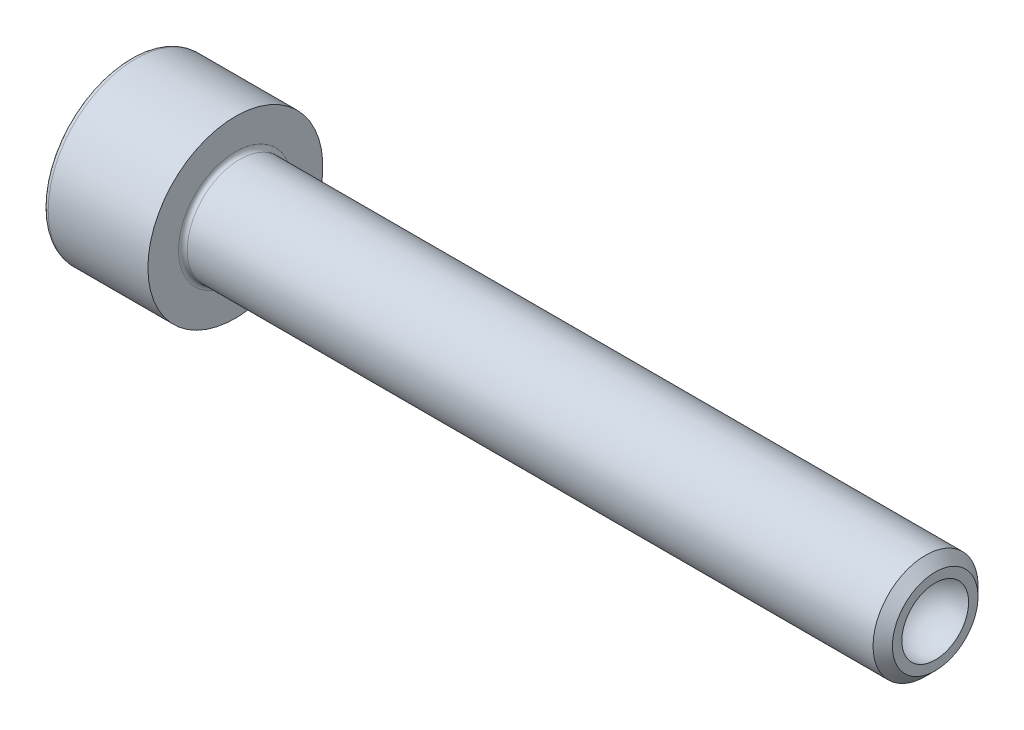
from build123d import *

# Parameters (mm, degrees)
FILLET1_R   = 0.25
FILLET2_R   = 0.3
HEX_2_DEPTH = 3


with BuildPart() as part:
    # BodySke → Base-Revolve (revolve)
    with BuildSketch(Plane.XY, mode=Mode.PRIVATE) as base_revolve_sk:
        Polygon((0, 0), (0, 5), (6, 5), (6, 3), (45.4455, 3), (46, 2.4455), (46, 0), align=None)
    revolve(base_revolve_sk.sketch.rotate(Axis((-31.75, 0, 0), (1, 0, 0)), 90), axis=Axis((-31.75, 0, 0), (1, 0, 0)))

    # Fillet1
    fillet1_edges = [part.edges().sort_by_distance(p)[0] for p in [
        (6, 0, -3),
    ]]
    fillet(fillet1_edges, radius=FILLET1_R)

    # Fillet2
    fillet2_edges = [part.edges().sort_by_distance(p)[0] for p in [
        (0, 0, -5),
    ]]
    fillet(fillet2_edges, radius=FILLET2_R)

    # Sketch2 → Hex-PreBroach (revolve, cut)
    with BuildSketch(Plane.XY, mode=Mode.PRIVATE) as hex_prebroach_sk:
        Polygon((0, 2.542), (3, 2.542), (4.467624384, 0), (0, 0), align=None)
    revolve(hex_prebroach_sk.sketch.rotate(Axis((0, 0, 0), (1, 0, 0)), 90), axis=Axis((0, 0, 0), (1, 0, 0)), mode=Mode.SUBTRACT)

    # Sketch3 → Hex 2 (cut)
    with BuildSketch(Plane(origin=(0, 0, 0), x_dir=(0, 0.500000000000001, 0.866025403784438), z_dir=(-1, 0, 0))):
        Polygon((1.467624384, 2.542), (-1.467624384, 2.542), (-2.935248769, 0), (-1.467624384, -2.542), (1.467624384, -2.542), (2.935248769, 0), align=None)
    extrude(amount=-HEX_2_DEPTH, mode=Mode.SUBTRACT)

    # Esquisse3 → Enlèvement de matière-Révolution1 (revolve, cut)
    with BuildSketch(Plane.XY, mode=Mode.PRIVATE) as enl_vement_de_mati_re_r_volution1_sk:
        with BuildLine():
            Line((43.4, 0), (46, 0))
            Line((46, 0), (46, -1.907878403))
            ThreePointArc((46, -1.907878403), (44.216784043, -1.61245155), (43.4, 0))
        make_face()
    revolve(enl_vement_de_mati_re_r_volution1_sk.sketch.rotate(Axis((43.4, 0, 0), (1, 0, 0)), 90), axis=Axis((43.4, 0, 0), (1, 0, 0)), mode=Mode.SUBTRACT)


solid = part.part
